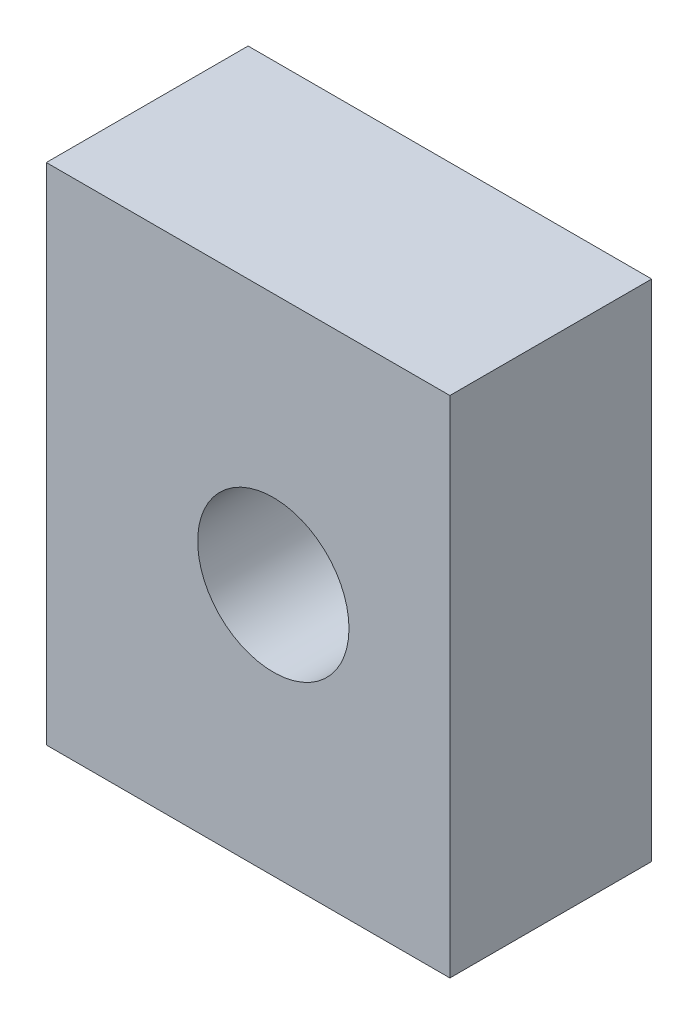
from build123d import *

# Parameters (mm, degrees)
SKETCH1_W           = 8
SKETCH1_H           = 10
SKETCH1_R           = 1.5
BOSS_EXTRUDE1_DEPTH = 4


with BuildPart() as part:
    # Sketch1 → Boss-Extrude1 (new body)
    with BuildSketch(Plane.XY):
        with Locations((4, 5)):
            Rectangle(SKETCH1_W, SKETCH1_H)
        with Locations((4.5, 5)):
            Circle(SKETCH1_R, mode=Mode.SUBTRACT)
    extrude(amount=BOSS_EXTRUDE1_DEPTH)


solid = part.part
